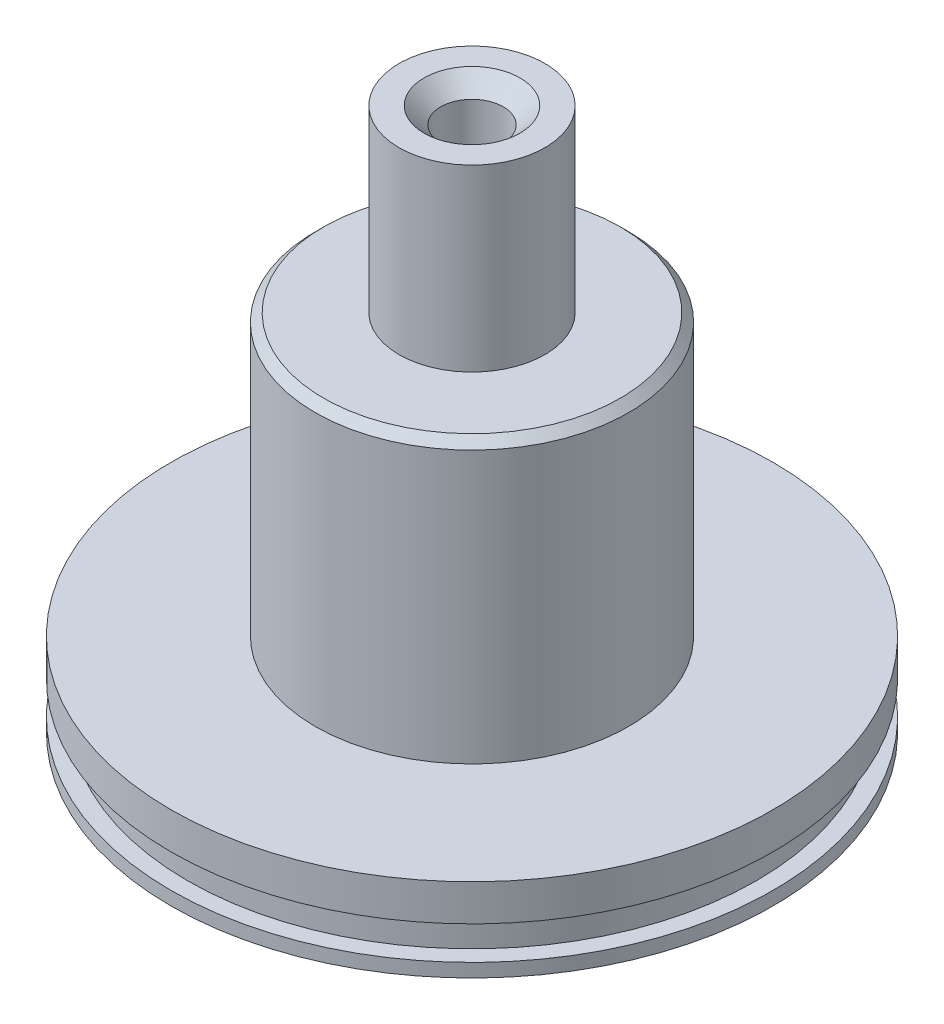
from build123d import *

# Parameters (mm, degrees)
SKETCH1_R           = 45.847
BOSS_EXTRUDE1_DEPTH = 12.7
SKETCH2_R           = 23.876
BOSS_EXTRUDE2_DEPTH = 42.672
SKETCH3_R           = 11.1125
BOSS_EXTRUDE3_DEPTH = 27.305
SKETCH5_R           = 4.7625
CUT_EXTRUDE1_DEPTH  = 25.4
CHAMFER1_SIZE       = 2.54
CHAMFER2_SIZE       = 1.27
SKETCH6_R           = 19.05
CUT_EXTRUDE2_DEPTH  = 50.8
CUT_EXTRUDE3_START  = -2.0574
SKETCH7_R           = 45.847
SKETCH7_R_2         = 43.307
CUT_EXTRUDE3_DEPTH  = 5.08


with BuildPart() as part:
    # Sketch1 → Boss-Extrude1 (new body)
    with BuildSketch(Plane(origin=(0, 0, 0), x_dir=(1, 0, 0), z_dir=(0, 1, 0))):
        with Locations(Location((0, 0, 0), (0, 0, 270))):
            Circle(SKETCH1_R)
    extrude(amount=BOSS_EXTRUDE1_DEPTH)

    # Sketch2 → Boss-Extrude2 (add)
    with BuildSketch(Plane(origin=(0, 12.7, 0), x_dir=(1, 0, 0), z_dir=(0, 1, 0))):
        with Locations(Location((0, 0, 0), (0, 0, 270))):
            Circle(SKETCH2_R)
    extrude(amount=BOSS_EXTRUDE2_DEPTH)

    # Sketch3 → Boss-Extrude3 (add)
    with BuildSketch(Plane(origin=(0, 55.372, 0), x_dir=(1, 0, 0), z_dir=(0, 1, 0))):
        with Locations(Location((0, 0, 0), (0, 0, 270))):
            Circle(SKETCH3_R)
    extrude(amount=BOSS_EXTRUDE3_DEPTH)

    # Sketch5 → Cut-Extrude1 (cut)
    with BuildSketch(Plane(origin=(0, 82.677, 0), x_dir=(1, 0, 0), z_dir=(0, 1, 0))):
        with Locations(Location((0, 0, 0), (0, 0, 270))):
            Circle(SKETCH5_R)
    extrude(amount=-CUT_EXTRUDE1_DEPTH, mode=Mode.SUBTRACT)

    # Chamfer1
    chamfer1_edges = [part.edges().sort_by_distance(p)[0] for p in [
        (0, 82.677, -4.7625),
    ]]
    chamfer(chamfer1_edges, length=CHAMFER1_SIZE)

    # Chamfer2
    chamfer2_edges = [part.edges().sort_by_distance(p)[0] for p in [
        (0, 55.372, -23.876),
    ]]
    chamfer(chamfer2_edges, length=CHAMFER2_SIZE)

    # Sketch6 → Cut-Extrude2 (cut)
    with BuildSketch(Plane.XZ):
        with Locations(Location((0, 0, 0), (0, 0, 270))):
            Circle(SKETCH6_R)
    extrude(amount=-CUT_EXTRUDE2_DEPTH, mode=Mode.SUBTRACT)

    # Sketch7 → Cut-Extrude3 (cut)
    with BuildSketch(Plane.XZ.offset(CUT_EXTRUDE3_START)):
        with Locations(Location((0, 0, 0), (0, 0, 270))):
            Circle(SKETCH7_R)
        with Locations(Location((0, 0, 0), (0, 0, 270))):
            Circle(SKETCH7_R_2, mode=Mode.SUBTRACT)
    extrude(amount=-CUT_EXTRUDE3_DEPTH, mode=Mode.SUBTRACT)


solid = part.part
